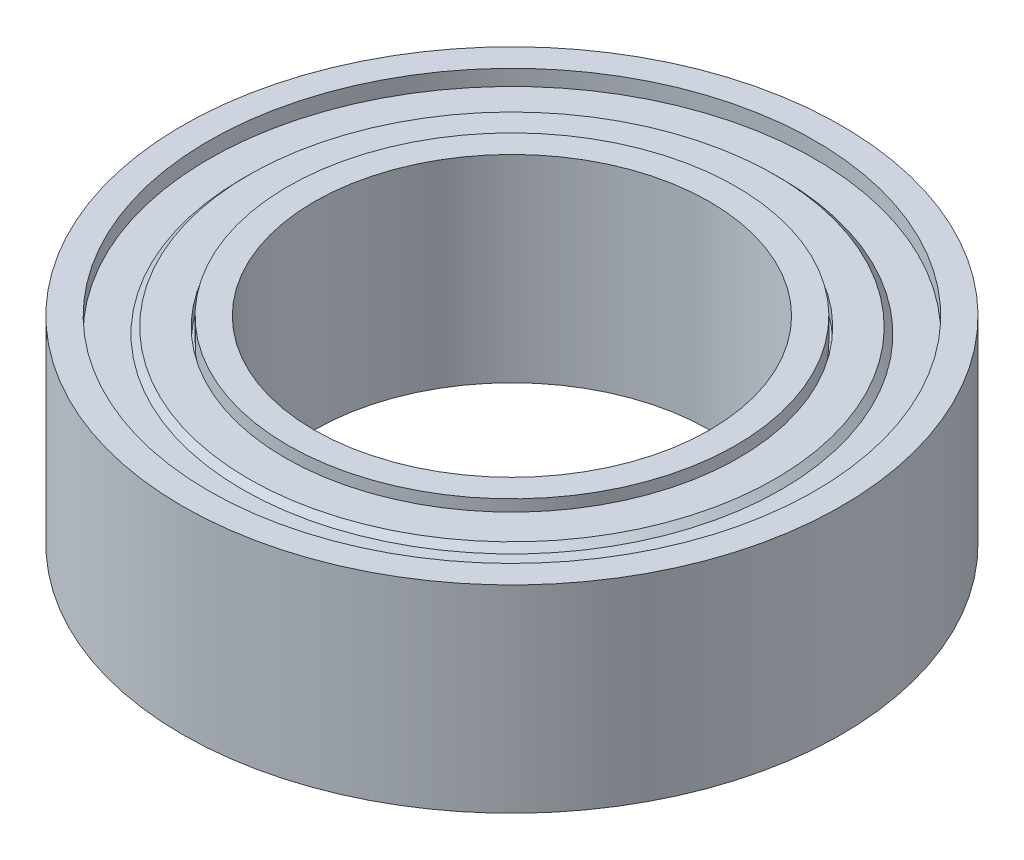
from build123d import *


with BuildPart() as part:
    # Sketch1 → Revolve1 (revolve)
    with BuildSketch(Plane(origin=(0, 0, 0), x_dir=(0, 0, -1), z_dir=(1, 0, 0))):
        Polygon((-5, 0), (-5, -1.5), (-4.6, -1.5), (-4.6, -1.261427486), (-4.086887916, -1.261427486), (-3.993641091, -1.354674311), (-3.441442884, -1.354674311), (-3.441442884, -1.138849172), (-3.4, -1.138849172), (-3.4, -1.5), (-3, -1.5), (-3, 0), align=None)
    revolve1 = revolve(axis=Axis((0, 0, 0), (0, -1, 0)))

    # Mirror1: Revolve1 across plane
    add(revolve1.mirror(Plane(origin=(0, 0, 3), x_dir=(0, 0, 1), z_dir=(0, 1, 0))))


solid = part.part
